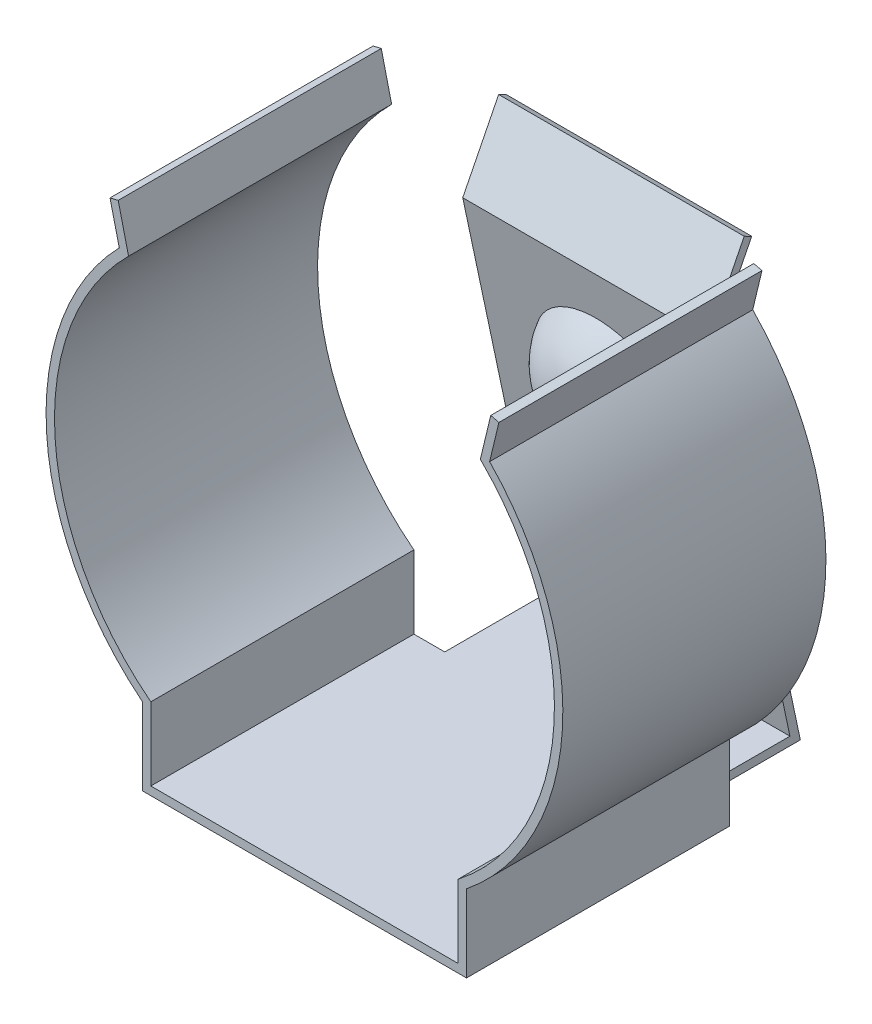
from build123d import *

# Parameters (mm, degrees)
EXTRUDE_THIN1_DEPTH = 9.525
EXTRUDE_THIN2_DEPTH = 4.445
SKETCH3_R           = 2.3749
SKETCH3_R_2         = 0.7874
CUT_EXTRUDE1_DEPTH  = 24.37151185


with BuildPart() as part:
    # Sketch1 → Extrude-Thin1 (new body)
    with BuildSketch(Plane.XY):
        with BuildLine():
            Line((6.7437, 17.77238356), (6.368570529, 16.208915196))
            ThreePointArc((6.368570529, 16.208915196), (9.034076329, 9.242376411), (5.5626, 2.640373995))
            Line((5.5626, 2.640373995), (5.5626, 0))
            Line((5.5626, 0), (-5.5626, 0))
            Line((-5.5626, 0), (-5.5626, 2.640373995))
            ThreePointArc((-5.5626, 2.640373995), (-9.034076329, 9.242376411), (-6.368570529, 16.208915196))
            Line((-6.368570529, 16.208915196), (-6.7437, 17.77238356))
            Line((-6.7437, 17.77238356), (-7.040088077, 17.701269935))
            Line((-7.040088077, 17.701269935), (-6.704567446, 16.30288369))
            ThreePointArc((-6.704567446, 16.30288369), (-9.337658307, 9.212943132), (-5.8674, 2.492992844))
            Line((-5.8674, 2.492992844), (-5.8674, -0.3048))
            Line((-5.8674, -0.3048), (5.8674, -0.3048))
            Line((5.8674, -0.3048), (5.8674, 2.492992844))
            ThreePointArc((5.8674, 2.492992844), (9.337658307, 9.212943132), (6.704567446, 16.30288369))
            Line((6.704567446, 16.30288369), (7.040088077, 17.701269935))
            Line((7.040088077, 17.701269935), (6.7437, 17.77238356))
        make_face()
    extrude(amount=EXTRUDE_THIN1_DEPTH)

    # Sketch2 → Extrude-Thin2 (add, symmetric)
    with BuildSketch(Plane(origin=(0, 0, 0), x_dir=(0, 0, -1), z_dir=(1, 0, 0))):
        Polygon((0, 0), (3.6068, 0), (0.650543656, 13.916451143), (1.950898512, 16.503333624), (2.223228171, 16.366440976), (0.970920321, 13.875141604), (3.983149653, -0.3048), (0, -0.3048), align=None)
    extrude(amount=EXTRUDE_THIN2_DEPTH, both=True)

    # Sketch3 → Cut-Extrude1 (cut, through all)
    with BuildSketch(Plane(origin=(0, 0.733106356, -3.451067026), x_dir=(1, 0, 0), z_dir=(0, -0.2077922077922076, 0.9781729900078207))):
        with Locations(Location((0, 9.029535065, 0), (0, 0, 270))):
            Circle(SKETCH3_R)
        with Locations(Location((2.89696051, 3.586960276, 0), (0, 0, 270))):
            Circle(SKETCH3_R_2)
    extrude(amount=-CUT_EXTRUDE1_DEPTH, mode=Mode.SUBTRACT)

    # Sketch4 → Revolve2 (revolve)
    with BuildSketch(Plane(origin=(0, 0, 0), x_dir=(0, 0, -1), z_dir=(1, 0, 0))):
        with BuildLine():
            Line((0.034373175, 9.2383225), (0.305728617, 9.295966237))
            ThreePointArc((0.305728617, 9.295966237), (0.288117278, 10.713567235), (1.081314286, 11.888616703))
            Line((1.081314286, 11.888616703), (1.017979221, 12.186763831))
            ThreePointArc((1.017979221, 12.186763831), (0.048720075, 10.871823503), (0.034373175, 9.2383225))
        make_face()
    revolve(axis=Axis((0, 9.2383225, -0.034373175), (0, 0.20779220779220853, -0.9781729900078205)))


solid = part.part
